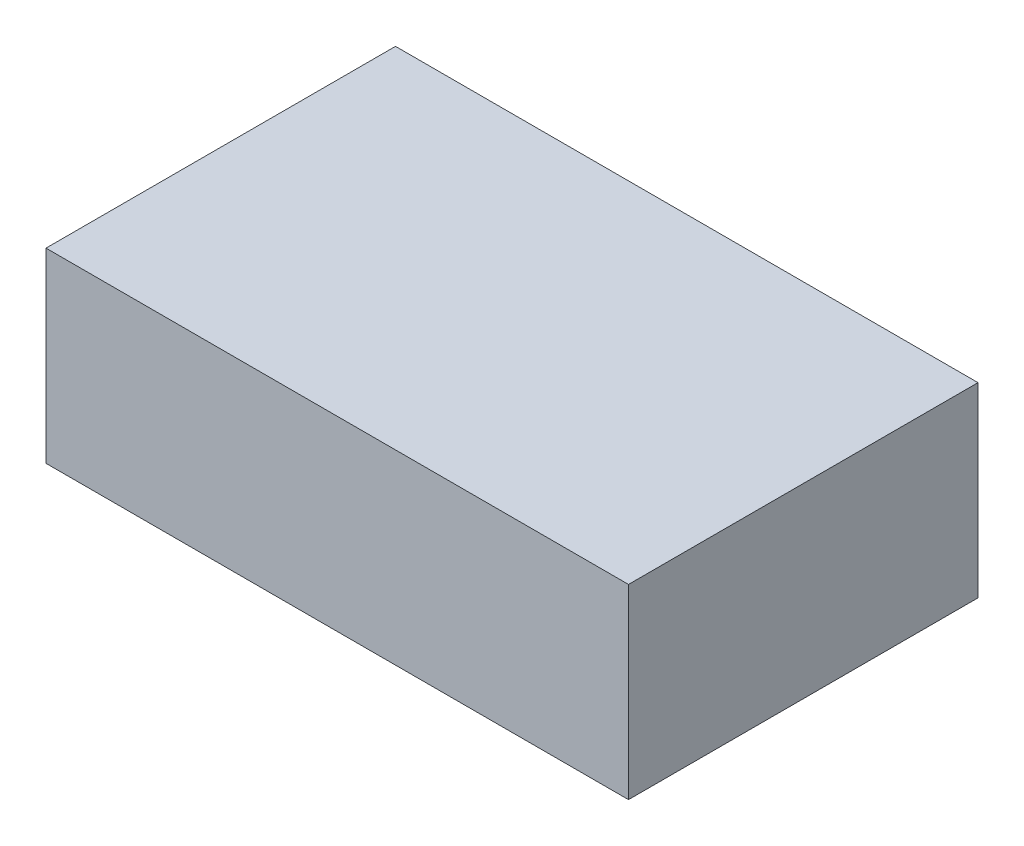
from build123d import *

# Parameters (mm, degrees)
SKETCH1_W           = 25
SKETCH1_H           = 8
BOSS_EXTRUDE2_DEPTH = 15


with BuildPart() as part:
    # Sketch1 → Boss-Extrude2 (new body)
    with BuildSketch(Plane.XY):
        with Locations((2.925201212, -1.809278351)):
            Rectangle(SKETCH1_W, SKETCH1_H)
    extrude(amount=BOSS_EXTRUDE2_DEPTH)


solid = part.part
